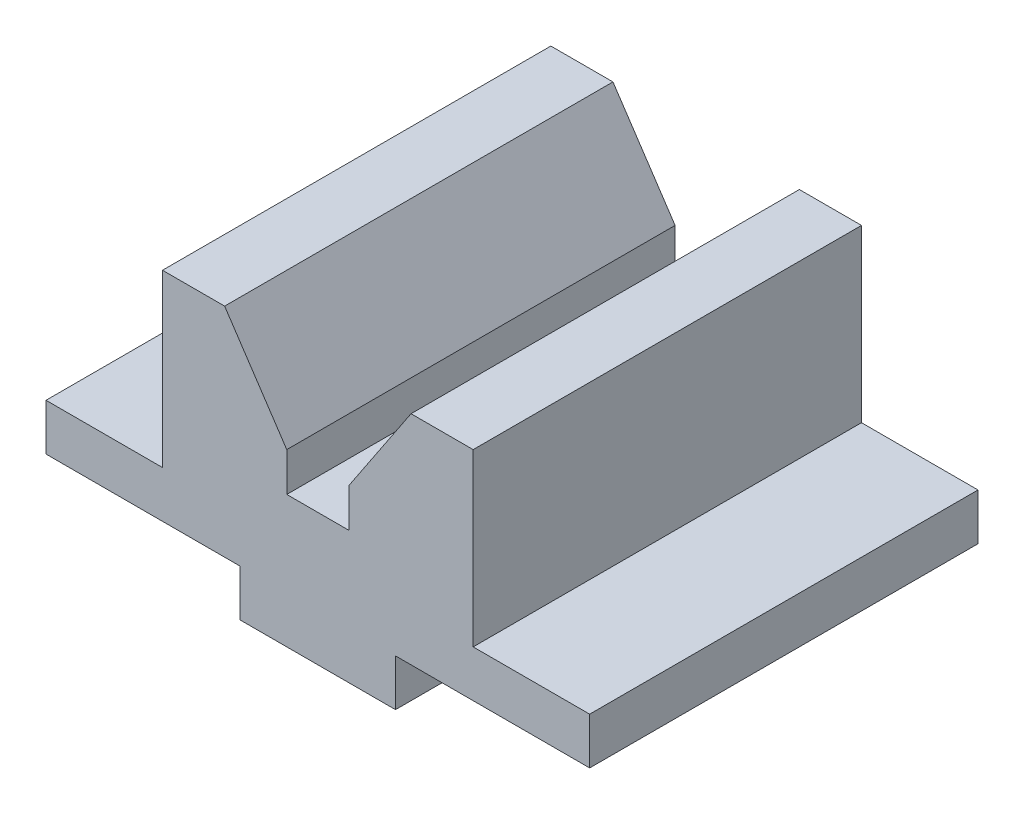
from build123d import *

# Parameters (mm, degrees)
BOSS_EXTRUDE1_DEPTH = 50


with BuildPart() as part:
    # Sketch1 → Boss-Extrude1 (new body)
    with BuildSketch(Plane.XY):
        Polygon((10, -6), (-10, -6), (-10, 0), (-35, 0), (-35, 6), (-20, 6), (-20, 28), (-12, 28), (-4, 16), (-4, 11), (4, 11), (4, 16), (12, 28), (20, 28), (20, 6), (35, 6), (35, 0), (10, 0), align=None)
    extrude(amount=BOSS_EXTRUDE1_DEPTH)


solid = part.part
